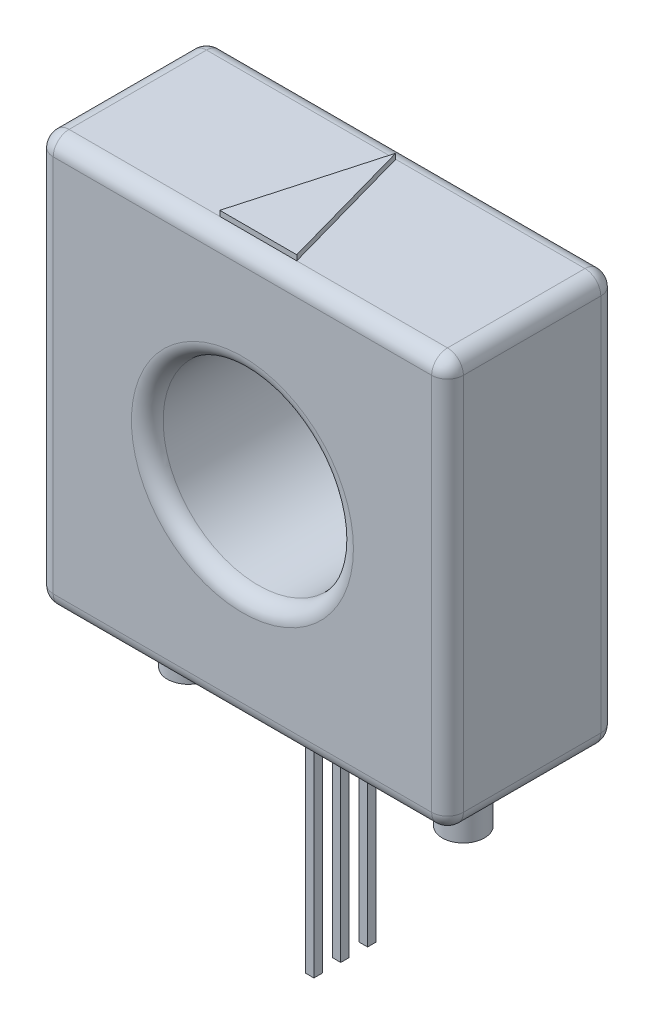
from build123d import *

# Parameters (mm, degrees)
SKETCH1_W           = 19.4
SKETCH1_H           = 19.4
SKETCH1_R           = 4.5
BOSS_EXTRUDE1_DEPTH = 8
FILLET1_R           = 0.75
SKETCH2_W           = 0.45
SKETCH2_H           = 0.216666666
BOSS_EXTRUDE2_DEPTH = 0.01
BOSS_EXTRUDE3_DEPTH = 0.25
SKETCH4_R           = 1
SKETCH4_R_2         = 0.7
SKETCH4_W           = 0.4
SKETCH4_H           = 0.4
BOSS_EXTRUDE4_DEPTH = 3
SKETCH5_W           = 0.4
SKETCH5_H           = 0.4
BOSS_EXTRUDE5_DEPTH = 9


with BuildPart() as part:
    # Sketch1 → Boss-Extrude1 (new body)
    with BuildSketch(Plane.XY):
        with Locations((9.7, -9.7)):
            Rectangle(SKETCH1_W, SKETCH1_H)
        with Locations((9.7, -9.7)):
            Circle(SKETCH1_R, mode=Mode.SUBTRACT)
    extrude(amount=BOSS_EXTRUDE1_DEPTH)

    # Fillet1
    fillet1_edges = [part.edges().sort_by_distance(p)[0] for p in [
        (19.4, -19.4, 4),
        (0, -19.4, 4),
        (0, 0, 4),
        (19.4, 0, 4),
        (19.4, -9.7, 8),
        (9.7, 0, 8),
        (0, -9.7, 8),
        (9.7, -19.4, 8),
        (9.7, -19.4, 0),
        (5.2, -9.7, 8),
        (0, -9.7, 0),
        (9.7, 0, 0),
        (19.4, -9.7, 0),
        (5.2, -9.7, 0),
    ]]
    fillet(fillet1_edges, radius=FILLET1_R)

    # Sketch2 → Boss-Extrude2 (add)
    # profile 1 of 13: a face of its own
    with BuildSketch(Plane(origin=(0, 0, 0), x_dir=(-1, 0, 0), z_dir=(0, 0, -1))):
        Polygon((-16.083333333, -2.4), (-15.842447917, -2.4), (-15.65, -3.229947917), (-15.429427083, -2.4), (-15.202604167, -2.4), (-14.983333333, -3.229947917), (-14.79140625, -2.4), (-14.55, -2.4), (-14.85078125, -3.7), (-15.09453125, -3.7), (-15.316666667, -2.859635417), (-15.540104167, -3.7), (-15.78203125, -3.7), align=None)
    # profile 2 of 13: a face of its own
    with BuildSketch(Plane(origin=(0, 0, 0), x_dir=(-1, 0, 0), z_dir=(0, 0, -1))):
        with BuildLine():
            Line((-13.175, -2.625520833), (-13.34609375, -2.7890625))
            add(Edge.make_bspline(
                [(-13.34609375, -2.7890625), (-13.360607316, -2.774055449), (-13.388956857, -2.744741976), (-13.434638636, -2.705933521), (-13.482146022, -2.673591925), (-13.530554856, -2.646354039), (-13.58073587, -2.625746637), (-13.632108836, -2.610729676), (-13.685001786, -2.601574402), (-13.7207977, -2.600526877), (-13.738802083, -2.6)],
                knots=[0, 0, 0, 0, 1.115251505, 2.178435587, 3.19620269, 4.182487026, 5.141301733, 6.088180966, 7.038406374, 8, 8, 8, 8], degree=3))
            add(Edge.make_bspline(
                [(-13.738802083, -2.6), (-13.753837931, -2.600416251), (-13.783509521, -2.601237677), (-13.827075189, -2.607259541), (-13.868748003, -2.617499983), (-13.908670614, -2.631613208), (-13.946725549, -2.649874972), (-13.982992594, -2.672271142), (-14.017382335, -2.698599447), (-14.049440503, -2.728723664), (-14.078766188, -2.761636634), (-14.104677299, -2.796754696), (-14.12638201, -2.833997394), (-14.144194713, -2.872987563), (-14.158070121, -2.913905667), (-14.167978905, -2.956724161), (-14.173709881, -3.001494036), (-14.174565267, -3.031928264), (-14.175, -3.047395833)],
                knots=[0, 0, 0, 0, 1.035432265, 2.043311493, 3.022114605, 3.98653278, 4.95457646, 5.923598177, 6.917315552, 7.932509744, 8.948865224, 9.949768934, 10.933144597, 11.912367597, 12.897413939, 13.903909035, 14.934704909, 16, 16, 16, 16], degree=3))
            add(Edge.make_bspline(
                [(-14.175, -3.047395833), (-14.174874715, -3.058252056), (-14.174627776, -3.079649894), (-14.171924589, -3.111303235), (-14.16757182, -3.142014459), (-14.161272286, -3.171737047), (-14.153394656, -3.200496756), (-14.144152402, -3.228541696), (-14.132558131, -3.255484347), (-14.119688315, -3.281637632), (-14.104720867, -3.306287925), (-14.088583198, -3.329794026), (-14.07108453, -3.352040709), (-14.052111523, -3.37293703), (-14.031397157, -3.392156425), (-14.009476821, -3.410276846), (-13.98598075, -3.426844675), (-13.961397015, -3.442275702), (-13.935513246, -3.455680767), (-13.909031728, -3.467823165), (-13.881550948, -3.477684598), (-13.853405502, -3.485633813), (-13.82469597, -3.492393432), (-13.795141549, -3.496555538), (-13.764998436, -3.499707452), (-13.744626751, -3.499902064), (-13.734375, -3.5)],
                knots=[0, 0, 0, 0, 1.103660481, 2.175337485, 3.227646561, 4.255952547, 5.262355991, 6.258840057, 7.255597736, 8.242457506, 9.22035537, 10.185017736, 11.140346927, 12.096287581, 13.051739095, 14.01125915, 14.986044842, 15.97314143, 16.960198552, 17.947847494, 18.933482797, 19.925264591, 20.920966487, 21.929612487, 22.958107872, 24, 24, 24, 24], degree=3))
            add(Edge.make_bspline(
                [(-13.734375, -3.5), (-13.716986268, -3.499497026), (-13.682821931, -3.498508812), (-13.632680855, -3.490781119), (-13.584901404, -3.478069501), (-13.546725852, -3.46305782), (-13.516816315, -3.448233589), (-13.494046627, -3.434521906), (-13.470500995, -3.419183883), (-13.446570491, -3.401640646), (-13.421985945, -3.382102722), (-13.397181332, -3.360142193), (-13.371521648, -3.336482188), (-13.354712243, -3.319595578), (-13.34609375, -3.3109375)],
                knots=[0, 0, 0, 0, 1.404581149, 2.759636711, 4.088442092, 5.392261763, 6.066678138, 6.783632037, 7.538459478, 8.336747902, 9.180226004, 10.074962426, 11.012997595, 12, 12, 12, 12], degree=3))
            Line((-13.34609375, -3.3109375), (-13.180208333, -3.48515625))
            add(Edge.make_bspline(
                [(-13.180208333, -3.48515625), (-13.191869185, -3.496414436), (-13.214628674, -3.518388009), (-13.248960732, -3.549588431), (-13.283249581, -3.577625479), (-13.316666875, -3.603516774), (-13.349760024, -3.62650804), (-13.382525518, -3.64662224), (-13.414592437, -3.664368089), (-13.446626662, -3.679446313), (-13.478827525, -3.692249292), (-13.51195843, -3.703271816), (-13.54612066, -3.712596475), (-13.581522862, -3.72012025), (-13.617834826, -3.726153302), (-13.655396385, -3.730225577), (-13.693969379, -3.732963232), (-13.720134039, -3.733209233), (-13.733333333, -3.733333333)],
                knots=[0, 0, 0, 0, 1.244526981, 2.429050516, 3.560637417, 4.644440555, 5.67424972, 6.652764056, 7.595344123, 8.486817594, 9.369275933, 10.254498637, 11.166417451, 12.086725134, 13.032340136, 13.991389299, 14.986715468, 16, 16, 16, 16], degree=3))
            add(Edge.make_bspline(
                [(-13.733333333, -3.733333333), (-13.757578803, -3.732715268), (-13.805020447, -3.731505886), (-13.87454494, -3.722545183), (-13.940591342, -3.707522723), (-14.003320331, -3.686276821), (-14.062711962, -3.659136176), (-14.11875104, -3.62586302), (-14.171347242, -3.586545755), (-14.220075695, -3.541645216), (-14.2641529, -3.49205634), (-14.303112045, -3.438811492), (-14.335339051, -3.381648993), (-14.362097828, -3.321413314), (-14.38302284, -3.257829578), (-14.397750501, -3.190829007), (-14.406832943, -3.120476292), (-14.407826575, -3.072423766), (-14.408333333, -3.047916667)],
                knots=[0, 0, 0, 0, 1.078019885, 2.10938526, 3.111377082, 4.085535484, 5.04941344, 6.010039228, 6.978205633, 7.964457913, 8.951525778, 9.924444315, 10.892603023, 11.863865945, 12.85144698, 13.863884204, 14.910567087, 16, 16, 16, 16], degree=3))
            add(Edge.make_bspline(
                [(-14.408333333, -3.047916667), (-14.408119202, -3.031933345), (-14.407694845, -3.000258309), (-14.403234817, -2.953598414), (-14.397017279, -2.908113362), (-14.38715372, -2.86427544), (-14.375264172, -2.821494069), (-14.360477958, -2.780234233), (-14.342818692, -2.740377347), (-14.322855575, -2.701856688), (-14.3002715, -2.664924608), (-14.275042609, -2.629898412), (-14.247818392, -2.596507703), (-14.217944695, -2.565195472), (-14.185855623, -2.535686792), (-14.151406297, -2.508141574), (-14.114803912, -2.48216479), (-14.075949399, -2.458426319), (-14.035597598, -2.436953609), (-13.994257452, -2.418013762), (-13.952030528, -2.402184412), (-13.909095366, -2.389054549), (-13.865270564, -2.379254036), (-13.820868934, -2.371835363), (-13.775512671, -2.367688277), (-13.74505987, -2.367009373), (-13.7296875, -2.366666667)],
                knots=[0, 0, 0, 0, 1.071919942, 2.124283339, 3.142214191, 4.149696895, 5.136002878, 6.119640489, 7.086990633, 8.058538607, 9.028339693, 9.988281803, 10.952401235, 11.916291999, 12.888973767, 13.874849856, 14.873389453, 15.898127285, 16.927174885, 17.938320013, 18.946391617, 19.950418109, 20.947802303, 21.956882652, 22.968648068, 24, 24, 24, 24], degree=3))
            add(Edge.make_bspline(
                [(-13.7296875, -2.366666667), (-13.716573292, -2.366863115), (-13.690481228, -2.367253968), (-13.651625766, -2.370512154), (-13.613081052, -2.375629103), (-13.574985088, -2.383349489), (-13.537065372, -2.392514563), (-13.499820212, -2.404514963), (-13.462662045, -2.417891671), (-13.426173643, -2.433880793), (-13.390304072, -2.451334365), (-13.355893634, -2.471136075), (-13.322364581, -2.49206735), (-13.290459896, -2.515366993), (-13.259581936, -2.540189884), (-13.229892165, -2.566651834), (-13.201651127, -2.595194043), (-13.18392862, -2.615360798), (-13.175, -2.625520833)],
                knots=[0, 0, 0, 0, 0.996412454, 1.982464992, 2.961075852, 3.949442424, 4.934965278, 5.923860011, 6.921385422, 7.934793307, 8.949617135, 9.951082467, 10.950285876, 11.951772932, 12.951063433, 13.960125323, 14.972308753, 16, 16, 16, 16], degree=3))
        make_face()
    # profile 3 of 13: a face of its own
    with BuildSketch(Plane(origin=(0, 0, 0), x_dir=(-1, 0, 0), z_dir=(0, 0, -1))):
        with BuildLine():
            Line((-12.275, -2.573697917), (-12.449479167, -2.733333333))
            add(Edge.make_bspline(
                [(-12.449479167, -2.733333333), (-12.456953106, -2.722790565), (-12.471302027, -2.70254992), (-12.494560132, -2.675447219), (-12.517713215, -2.652326598), (-12.540975774, -2.633284644), (-12.564554001, -2.618437052), (-12.588406967, -2.607924793), (-12.612399443, -2.60124205), (-12.628518683, -2.600409888), (-12.636458333, -2.6)],
                knots=[0, 0, 0, 0, 1.299362458, 2.494594718, 3.587462134, 4.587049575, 5.512617175, 6.380583204, 7.202344345, 8, 8, 8, 8], degree=3))
            add(Edge.make_bspline(
                [(-12.636458333, -2.6), (-12.643864211, -2.600259724), (-12.658163016, -2.600761182), (-12.678547023, -2.605745638), (-12.696644235, -2.614348076), (-12.71243699, -2.625596489), (-12.724947181, -2.639148218), (-12.734935599, -2.653360498), (-12.740559918, -2.66904764), (-12.741300189, -2.679822203), (-12.741666667, -2.68515625)],
                knots=[0, 0, 0, 0, 1.185010067, 2.2879431, 3.333075148, 4.379039566, 5.372662701, 6.27520591, 7.14612461, 8, 8, 8, 8], degree=3))
            add(Edge.make_bspline(
                [(-12.741666667, -2.68515625), (-12.741437013, -2.690567217), (-12.740974524, -2.701464152), (-12.736507503, -2.717434968), (-12.729774428, -2.733040314), (-12.723340699, -2.74254003), (-12.720052083, -2.747395833)],
                knots=[0, 0, 0, 0, 0.967525499, 1.948461899, 2.951351359, 4, 4, 4, 4], degree=3))
            add(Edge.make_bspline(
                [(-12.720052083, -2.747395833), (-12.717062376, -2.751170198), (-12.710180464, -2.759858288), (-12.697058067, -2.773618867), (-12.680579093, -2.790476782), (-12.660109396, -2.809852337), (-12.636498729, -2.832442353), (-12.608652707, -2.857358809), (-12.57737286, -2.885373337), (-12.55513987, -2.90488164), (-12.543489583, -2.915104167)],
                knots=[0, 0, 0, 0, 0.473873513, 1.090794244, 1.870441696, 2.795289791, 3.865433203, 5.087734844, 6.473946851, 8, 8, 8, 8], degree=3))
            add(Edge.make_bspline(
                [(-12.543489583, -2.915104167), (-12.532554113, -2.924568265), (-12.511800863, -2.942529156), (-12.482273108, -2.968021758), (-12.45632313, -2.99095683), (-12.433572896, -3.010990166), (-12.414367278, -3.028331962), (-12.398625534, -3.043065111), (-12.386155407, -3.054902786), (-12.379066869, -3.062052749), (-12.376041667, -3.065104167)],
                knots=[0, 0, 0, 0, 1.543621617, 2.929473131, 4.163658386, 5.240097082, 6.164993805, 6.925417477, 7.541396219, 8, 8, 8, 8], degree=3))
            add(Edge.make_bspline(
                [(-12.376041667, -3.065104167), (-12.364564678, -3.077524726), (-12.342501876, -3.101401404), (-12.31382801, -3.138402745), (-12.290228491, -3.174523598), (-12.271971456, -3.210443637), (-12.258183009, -3.246681115), (-12.24846197, -3.284124755), (-12.242639976, -3.323165819), (-12.241993599, -3.34980658), (-12.241666667, -3.36328125)],
                knots=[0, 0, 0, 0, 1.206664779, 2.319633467, 3.337109185, 4.282041471, 5.190008762, 6.099243693, 7.03861361, 8, 8, 8, 8], degree=3))
            add(Edge.make_bspline(
                [(-12.241666667, -3.36328125), (-12.241899369, -3.376410664), (-12.242355938, -3.402171062), (-12.247948044, -3.439867568), (-12.255922057, -3.47594476), (-12.268251281, -3.510010067), (-12.283278067, -3.542622662), (-12.302116312, -3.573274543), (-12.324239249, -3.60227592), (-12.349595531, -3.629108359), (-12.377642589, -3.653456936), (-12.407725725, -3.675132616), (-12.440139107, -3.69302865), (-12.474605799, -3.707764757), (-12.511107352, -3.719114705), (-12.549600282, -3.727503373), (-12.590143466, -3.73253812), (-12.61786748, -3.733064443), (-12.63203125, -3.733333333)],
                knots=[0, 0, 0, 0, 1.043214005, 2.046824704, 3.02475056, 3.976699089, 4.921714032, 5.875962561, 6.831408892, 7.817874052, 8.806269674, 9.781291748, 10.760897367, 11.74438705, 12.757449933, 13.795994037, 14.874007457, 16, 16, 16, 16], degree=3))
            add(Edge.make_bspline(
                [(-12.63203125, -3.733333333), (-12.643149689, -3.733136085), (-12.665170573, -3.73274542), (-12.697626029, -3.729555964), (-12.728965439, -3.724408521), (-12.759153505, -3.717030698), (-12.788326227, -3.707681996), (-12.816484805, -3.696262915), (-12.843434851, -3.682596462), (-12.86938028, -3.666963676), (-12.894194966, -3.648811951), (-12.918192682, -3.628512395), (-12.941135059, -3.605752791), (-12.963132285, -3.580586964), (-12.984043615, -3.552943651), (-13.004553552, -3.523207836), (-13.023750573, -3.490827664), (-13.035609427, -3.46811271), (-13.041666667, -3.456510417)],
                knots=[0, 0, 0, 0, 1.016823716, 2.013894106, 2.979844003, 3.91962641, 4.853723003, 5.779685073, 6.695824784, 7.614987388, 8.547259901, 9.504950863, 10.487499108, 11.500346958, 12.559593716, 13.656357062, 14.802919212, 16, 16, 16, 16], degree=3))
            Line((-13.041666667, -3.456510417), (-12.836458333, -3.333333333))
            add(Edge.make_bspline(
                [(-12.836458333, -3.333333333), (-12.828881632, -3.346503453), (-12.814356449, -3.371751697), (-12.789742167, -3.405675914), (-12.764526093, -3.43472639), (-12.738125251, -3.458389656), (-12.710860668, -3.476982121), (-12.682600649, -3.490269587), (-12.653325338, -3.498494513), (-12.633384327, -3.499498966), (-12.6234375, -3.5)],
                knots=[0, 0, 0, 0, 1.283663364, 2.460892379, 3.537111102, 4.529833553, 5.449777664, 6.316464042, 7.160231139, 8, 8, 8, 8], degree=3))
            add(Edge.make_bspline(
                [(-12.6234375, -3.5), (-12.613320153, -3.499590828), (-12.593691027, -3.498796976), (-12.56567296, -3.491464402), (-12.539984936, -3.479951721), (-12.517780398, -3.463524714), (-12.498978995, -3.444565452), (-12.48510248, -3.423472405), (-12.47638516, -3.400650238), (-12.475463528, -3.384796459), (-12.475, -3.376822917)],
                knots=[0, 0, 0, 0, 1.13588714, 2.203786484, 3.234766741, 4.283437687, 5.291419208, 6.222934724, 7.106237994, 8, 8, 8, 8], degree=3))
            add(Edge.make_bspline(
                [(-12.475, -3.376822917), (-12.475428049, -3.369404833), (-12.47629759, -3.354335707), (-12.482702362, -3.331930339), (-12.492714973, -3.30953516), (-12.504560599, -3.291166029), (-12.516615006, -3.275786053), (-12.528141738, -3.26246), (-12.542178249, -3.247737044), (-12.558688948, -3.231598666), (-12.577455685, -3.213902794), (-12.59849427, -3.194651161), (-12.622045615, -3.174013352), (-12.638691753, -3.159955081), (-12.647395833, -3.152604167)],
                knots=[0, 0, 0, 0, 0.916159276, 1.861089862, 2.860218735, 3.940849679, 4.552606315, 5.27541173, 6.11797699, 7.06649574, 8.129236253, 9.306560635, 10.591630461, 12, 12, 12, 12], degree=3))
            add(Edge.make_bspline(
                [(-12.647395833, -3.152604167), (-12.663942637, -3.138603984), (-12.695700961, -3.111733396), (-12.740579503, -3.072046384), (-12.781019087, -3.034955235), (-12.816670434, -3.000001421), (-12.847987798, -2.967830457), (-12.874759083, -2.93818104), (-12.896690195, -2.910824465), (-12.919767962, -2.878422432), (-12.941696455, -2.838938328), (-12.960648895, -2.791434374), (-12.972944438, -2.743936448), (-12.974321983, -2.712048957), (-12.975, -2.696354167)],
                knots=[0, 0, 0, 0, 1.345494975, 2.582412109, 3.71882943, 4.751509156, 5.681369928, 6.505683931, 7.230279997, 7.856715994, 8.973648664, 10.023341002, 11.027102913, 12, 12, 12, 12], degree=3))
            add(Edge.make_bspline(
                [(-12.975, -2.696354167), (-12.974718013, -2.685224264), (-12.97416247, -2.66329716), (-12.969206934, -2.631056549), (-12.961800697, -2.599947069), (-12.951044714, -2.57008222), (-12.937084747, -2.54149941), (-12.92013091, -2.514058714), (-12.899919941, -2.48801269), (-12.877143544, -2.463378604), (-12.852049785, -2.440865853), (-12.825233915, -2.420996095), (-12.796847714, -2.404213808), (-12.767064834, -2.390291682), (-12.735700723, -2.37963518), (-12.702986439, -2.372081319), (-12.668875059, -2.367588524), (-12.645673235, -2.366977781), (-12.633854167, -2.366666667)],
                knots=[0, 0, 0, 0, 1.010766082, 1.991317756, 2.957454644, 3.913069143, 4.869106762, 5.843196583, 6.838735724, 7.860187025, 8.887984031, 9.89767229, 10.887916223, 11.879572884, 12.879850636, 13.892031539, 14.926195476, 16, 16, 16, 16], degree=3))
            add(Edge.make_bspline(
                [(-12.633854167, -2.366666667), (-12.618537239, -2.367226993), (-12.58802429, -2.368343221), (-12.542910014, -2.377071765), (-12.498844276, -2.390798319), (-12.463335279, -2.407357897), (-12.435081432, -2.423399167), (-12.413427498, -2.438167948), (-12.391393455, -2.455086381), (-12.368801611, -2.47420778), (-12.346071758, -2.495892416), (-12.322557578, -2.519624072), (-12.29857948, -2.545607842), (-12.282997519, -2.564170527), (-12.275, -2.573697917)],
                knots=[0, 0, 0, 0, 1.282922637, 2.555718331, 3.837320111, 5.142675274, 5.830281639, 6.55870424, 7.337177975, 8.157850921, 9.037902056, 9.96903443, 10.957596896, 12, 12, 12, 12], degree=3))
        make_face()
    # profile 4 of 13: a face of its own
    with BuildSketch(Plane(origin=(0, 0, 0), x_dir=(-1, 0, 0), z_dir=(0, 0, -1))):
        Polygon((-11.869010417, -2.4), (-11.508333333, -2.4), (-11.508333333, -3.7), (-11.741666667, -3.7), (-11.741666667, -2.616666667), (-12.008333333, -2.616666667), align=None)
    # profile 5 of 13: a face of its own
    with BuildSketch(Plane(origin=(0, 0, 0), x_dir=(-1, 0, 0), z_dir=(0, 0, -1))):
        Polygon((-11.058333333, -2.4), (-10.225, -2.4), (-10.225, -2.52109375), (-10.7984375, -3.733333333), (-11.005208333, -3.629166667), (-10.526041667, -2.616666667), (-11.058333333, -2.616666667), align=None)
    # profile 6 of 13: a face of its own
    with BuildSketch(Plane(origin=(0, 0, 0), x_dir=(-1, 0, 0), z_dir=(0, 0, -1))):
        with BuildLine():
            add(Edge.make_bspline(
                [(-9.670572917, -2.366666667), (-9.659278615, -2.366834334), (-9.637071, -2.367164012), (-9.604363363, -2.370734697), (-9.572856866, -2.376129005), (-9.542428251, -2.383652185), (-9.513296547, -2.393608844), (-9.485249726, -2.405526796), (-9.458621628, -2.420031159), (-9.433072658, -2.436414583), (-9.408612658, -2.454962941), (-9.385829508, -2.476109027), (-9.364307138, -2.499366269), (-9.344511429, -2.525086274), (-9.326003999, -2.553035091), (-9.308845659, -2.583217153), (-9.293167762, -2.61578018), (-9.278794595, -2.650782935), (-9.265942064, -2.688750095), (-9.255116392, -2.730117158), (-9.245831568, -2.774893572), (-9.237994521, -2.823190792), (-9.23207098, -2.875073016), (-9.228078394, -2.930505778), (-9.225338493, -2.989382209), (-9.225114881, -3.029770958), (-9.225, -3.050520833)],
                knots=[0, 0, 0, 0, 0.879237366, 1.728815576, 2.559023295, 3.367336655, 4.166867292, 4.954216142, 5.737608147, 6.525189134, 7.316157332, 8.124696809, 8.942788509, 9.781158001, 10.649253743, 11.551476218, 12.482711956, 13.461909668, 14.496590415, 15.601789533, 16.789733467, 18.056700938, 19.410929216, 20.8549011, 22.384193279, 24, 24, 24, 24], degree=3))
            add(Edge.make_bspline(
                [(-9.225, -3.050520833), (-9.225124156, -3.071530313), (-9.225365388, -3.112351356), (-9.227964496, -3.171766301), (-9.232440282, -3.227601538), (-9.238208999, -3.279851288), (-9.246110563, -3.328487961), (-9.255364393, -3.373637493), (-9.266360944, -3.415283517), (-9.279636833, -3.453332197), (-9.293922999, -3.488396424), (-9.309643782, -3.520895961), (-9.326525172, -3.550918834), (-9.344179959, -3.57891798), (-9.363576045, -3.604067996), (-9.383769367, -3.627224117), (-9.405639179, -3.647504294), (-9.428264677, -3.665953678), (-9.452474724, -3.681897648), (-9.478019649, -3.695841981), (-9.505354873, -3.707152492), (-9.533982122, -3.71698977), (-9.564389353, -3.724051874), (-9.596093398, -3.729655422), (-9.629452192, -3.732752286), (-9.652164202, -3.733136472), (-9.663802083, -3.733333333)],
                knots=[0, 0, 0, 0, 1.643780988, 3.193836972, 4.651895693, 6.025988579, 7.305620092, 8.505800249, 9.631074763, 10.672816429, 11.65661981, 12.592235626, 13.49536222, 14.350718032, 15.179365177, 15.97804903, 16.751647189, 17.51006938, 18.259804725, 19.016521909, 19.783502495, 20.571750527, 21.382245291, 22.22305063, 23.089471752, 24, 24, 24, 24], degree=3))
            add(Edge.make_bspline(
                [(-9.663802083, -3.733333333), (-9.675439651, -3.733132675), (-9.698237475, -3.732739587), (-9.731686474, -3.729678448), (-9.763558535, -3.724029174), (-9.794206336, -3.716935552), (-9.823416572, -3.707174258), (-9.851329306, -3.695525345), (-9.877729912, -3.681668017), (-9.902691491, -3.665686899), (-9.926128816, -3.647360956), (-9.948406104, -3.626886203), (-9.969474074, -3.60431454), (-9.989012232, -3.579393144), (-10.007340556, -3.552454666), (-10.02426791, -3.523191479), (-10.039784121, -3.491646191), (-10.05437454, -3.457774832), (-10.067051767, -3.420848188), (-10.078333911, -3.380536511), (-10.087575946, -3.336503769), (-10.095009009, -3.288764107), (-10.100943562, -3.237418666), (-10.105358188, -3.182442661), (-10.107971733, -3.123810486), (-10.108210435, -3.083509671), (-10.108333333, -3.062760417)],
                knots=[0, 0, 0, 0, 0.917216111, 1.796812873, 2.643793957, 3.46689424, 4.273913431, 5.068098542, 5.848489301, 6.620921603, 7.401012384, 8.190319798, 9.003608147, 9.831726257, 10.68377682, 11.569763213, 12.493818149, 13.453288342, 14.474581811, 15.568529029, 16.750744269, 18.018426408, 19.375425659, 20.823733699, 22.36466933, 24, 24, 24, 24], degree=3))
            add(Edge.make_bspline(
                [(-10.108333333, -3.062760417), (-10.108110715, -3.033930961), (-10.107681169, -2.978304155), (-10.102237653, -2.897939594), (-10.094247952, -2.823656478), (-10.082512974, -2.755579065), (-10.068002836, -2.693455216), (-10.049421848, -2.63769417), (-10.028268745, -2.587524349), (-10.010243584, -2.557803445), (-10.0015625, -2.543489583)],
                knots=[0, 0, 0, 0, 1.288568992, 2.486310467, 3.599230591, 4.627010532, 5.572937695, 6.447898582, 7.252493626, 8, 8, 8, 8], degree=3))
            add(Edge.make_bspline(
                [(-10.0015625, -2.543489583), (-9.991468549, -2.52942765), (-9.971732886, -2.501933799), (-9.937224527, -2.465839513), (-9.900149788, -2.434969911), (-9.859747176, -2.410023602), (-9.816655674, -2.39035094), (-9.77050532, -2.376456361), (-9.721466539, -2.368360731), (-9.68779079, -2.367239787), (-9.670572917, -2.366666667)],
                knots=[0, 0, 0, 0, 1.058512271, 2.069600068, 3.047294572, 4.004278952, 4.967380941, 5.939006123, 6.946246673, 8, 8, 8, 8], degree=3))
        make_face()
        with BuildLine():
            add(Edge.make_bspline(
                [(-9.66484375, -2.6), (-9.675053892, -2.60048394), (-9.695071192, -2.601432721), (-9.724117246, -2.609486526), (-9.751505862, -2.621926062), (-9.772339651, -2.636895099), (-9.787933535, -2.651244716), (-9.798829093, -2.664230653), (-9.809336142, -2.678722022), (-9.818616497, -2.695372746), (-9.827379574, -2.713584543), (-9.835943742, -2.733440084), (-9.84296411, -2.755427064), (-9.849861437, -2.779171043), (-9.855904138, -2.805328477), (-9.860966597, -2.834113176), (-9.865489459, -2.865712329), (-9.868644209, -2.900146633), (-9.871585383, -2.937380062), (-9.873693756, -2.977495557), (-9.874575214, -3.020482295), (-9.874855403, -3.050086624), (-9.875, -3.065364583)],
                knots=[0, 0, 0, 0, 1.076674018, 2.110852608, 3.161083442, 4.239746716, 4.804137807, 5.395870207, 6.026861976, 6.692161227, 7.405688833, 8.16177676, 8.973626916, 9.841385931, 10.773283133, 11.807421078, 12.927755683, 14.143907515, 15.458935494, 16.872852025, 18.386167141, 20, 20, 20, 20], degree=3))
            add(Edge.make_bspline(
                [(-9.875, -3.065364583), (-9.87476201, -3.085157918), (-9.874305647, -3.123113105), (-9.87191543, -3.177693984), (-9.867124439, -3.22736698), (-9.861165413, -3.272468744), (-9.852795718, -3.312706779), (-9.843165842, -3.348461774), (-9.831273802, -3.37927794), (-9.817530257, -3.405600948), (-9.802308663, -3.427993876), (-9.785784952, -3.447027965), (-9.768521699, -3.463510589), (-9.749980061, -3.476899221), (-9.730204272, -3.487159651), (-9.709359425, -3.494539852), (-9.687432272, -3.499057581), (-9.672416784, -3.499684044), (-9.66484375, -3.5)],
                knots=[0, 0, 0, 0, 1.771748488, 3.397459088, 4.888034009, 6.237357457, 7.467047327, 8.564189669, 9.548206622, 10.417051504, 11.216568818, 11.965764335, 12.669334354, 13.348544111, 14.005342236, 14.656555988, 15.322436492, 16, 16, 16, 16], degree=3))
            add(Edge.make_bspline(
                [(-9.66484375, -3.5), (-9.657530599, -3.4997838), (-9.643212358, -3.499360506), (-9.622333156, -3.495015454), (-9.602588299, -3.487951344), (-9.584037403, -3.477958665), (-9.566614114, -3.465251444), (-9.550403586, -3.44977384), (-9.535528076, -3.431371578), (-9.526861537, -3.417714379), (-9.522395833, -3.410677083)],
                knots=[0, 0, 0, 0, 0.992283464, 1.942767638, 2.88273346, 3.832339453, 4.79467288, 5.803907806, 6.868395428, 8, 8, 8, 8], degree=3))
            add(Edge.make_bspline(
                [(-9.522395833, -3.410677083), (-9.51713822, -3.401060844), (-9.506113431, -3.38089637), (-9.493355526, -3.346869572), (-9.482616633, -3.308492968), (-9.473373824, -3.265647126), (-9.467052307, -3.218163056), (-9.461608224, -3.16634186), (-9.458982408, -3.109922587), (-9.458555305, -3.070835111), (-9.458333333, -3.050520833)],
                knots=[0, 0, 0, 0, 0.710965849, 1.490837728, 2.352621235, 3.297892224, 4.334225155, 5.461620853, 6.680770821, 8, 8, 8, 8], degree=3))
            add(Edge.make_bspline(
                [(-9.458333333, -3.050520833), (-9.458419076, -3.030030218), (-9.458584116, -2.990589281), (-9.461612123, -2.933967177), (-9.465828855, -2.882252282), (-9.471996715, -2.835560054), (-9.479932789, -2.793777146), (-9.48971403, -2.756906288), (-9.501245385, -2.724874816), (-9.514920198, -2.69771467), (-9.530065904, -2.674632271), (-9.546143532, -2.654829363), (-9.563221067, -2.637922139), (-9.581269948, -2.623846976), (-9.600707924, -2.613092496), (-9.621163703, -2.605498943), (-9.642679222, -2.600905098), (-9.657355852, -2.600305772), (-9.66484375, -2.6)],
                knots=[0, 0, 0, 0, 1.793836731, 3.452829483, 4.963243077, 6.335886805, 7.574563692, 8.684454726, 9.672768357, 10.54971625, 11.340229787, 12.085688095, 12.778991901, 13.440269426, 14.083255152, 14.715733572, 15.344777694, 16, 16, 16, 16], degree=3))
        make_face(mode=Mode.SUBTRACT)
    # profile 7 of 13: a face of its own
    with BuildSketch(Plane(origin=(0, 0, 0), x_dir=(-1, 0, 0), z_dir=(0, 0, -1))):
        with BuildLine():
            add(Edge.make_bspline(
                [(-8.670572917, -2.366666667), (-8.659278615, -2.366834334), (-8.637071, -2.367164012), (-8.604363363, -2.370734697), (-8.572856866, -2.376129005), (-8.542428251, -2.383652185), (-8.513296547, -2.393608844), (-8.485249726, -2.405526796), (-8.458621628, -2.420031159), (-8.433072658, -2.436414583), (-8.408612658, -2.454962941), (-8.385829508, -2.476109027), (-8.364307138, -2.499366269), (-8.344511429, -2.525086274), (-8.326003999, -2.553035091), (-8.308845659, -2.583217153), (-8.293167762, -2.61578018), (-8.278794595, -2.650782935), (-8.265942064, -2.688750095), (-8.255116392, -2.730117158), (-8.245831568, -2.774893572), (-8.237994521, -2.823190792), (-8.23207098, -2.875073016), (-8.228078394, -2.930505778), (-8.225338493, -2.989382209), (-8.225114881, -3.029770958), (-8.225, -3.050520833)],
                knots=[0, 0, 0, 0, 0.879237366, 1.728815576, 2.559023295, 3.367336655, 4.166867292, 4.954216142, 5.737608147, 6.525189134, 7.316157332, 8.124696809, 8.942788509, 9.781158001, 10.649253743, 11.551476218, 12.482711956, 13.461909668, 14.496590415, 15.601789533, 16.789733467, 18.056700938, 19.410929216, 20.8549011, 22.384193279, 24, 24, 24, 24], degree=3))
            add(Edge.make_bspline(
                [(-8.225, -3.050520833), (-8.225124156, -3.071530313), (-8.225365388, -3.112351356), (-8.227964496, -3.171766301), (-8.232440282, -3.227601538), (-8.238208999, -3.279851288), (-8.246110563, -3.328487961), (-8.255364393, -3.373637493), (-8.266360944, -3.415283517), (-8.279636833, -3.453332197), (-8.293922999, -3.488396424), (-8.309643782, -3.520895961), (-8.326525172, -3.550918834), (-8.344179959, -3.57891798), (-8.363576045, -3.604067996), (-8.383769367, -3.627224117), (-8.405639179, -3.647504294), (-8.428264677, -3.665953678), (-8.452474724, -3.681897648), (-8.478019649, -3.695841981), (-8.505354873, -3.707152492), (-8.533982122, -3.71698977), (-8.564389353, -3.724051874), (-8.596093398, -3.729655422), (-8.629452192, -3.732752286), (-8.652164202, -3.733136472), (-8.663802083, -3.733333333)],
                knots=[0, 0, 0, 0, 1.643780988, 3.193836972, 4.651895693, 6.025988579, 7.305620092, 8.505800249, 9.631074763, 10.672816429, 11.65661981, 12.592235626, 13.49536222, 14.350718032, 15.179365177, 15.97804903, 16.751647189, 17.51006938, 18.259804725, 19.016521909, 19.783502495, 20.571750527, 21.382245291, 22.22305063, 23.089471752, 24, 24, 24, 24], degree=3))
            add(Edge.make_bspline(
                [(-8.663802083, -3.733333333), (-8.675439651, -3.733132675), (-8.698237475, -3.732739587), (-8.731686474, -3.729678448), (-8.763558535, -3.724029174), (-8.794206336, -3.716935552), (-8.823416572, -3.707174258), (-8.851329306, -3.695525345), (-8.877729912, -3.681668017), (-8.902691491, -3.665686899), (-8.926128816, -3.647360956), (-8.948406104, -3.626886203), (-8.969474074, -3.60431454), (-8.989012232, -3.579393144), (-9.007340556, -3.552454666), (-9.02426791, -3.523191479), (-9.039784121, -3.491646191), (-9.05437454, -3.457774832), (-9.067051767, -3.420848188), (-9.078333911, -3.380536511), (-9.087575946, -3.336503769), (-9.095009009, -3.288764107), (-9.100943562, -3.237418666), (-9.105358188, -3.182442661), (-9.107971733, -3.123810486), (-9.108210435, -3.083509671), (-9.108333333, -3.062760417)],
                knots=[0, 0, 0, 0, 0.917216111, 1.796812873, 2.643793957, 3.46689424, 4.273913431, 5.068098542, 5.848489301, 6.620921603, 7.401012384, 8.190319798, 9.003608147, 9.831726257, 10.68377682, 11.569763213, 12.493818149, 13.453288342, 14.474581811, 15.568529029, 16.750744269, 18.018426408, 19.375425659, 20.823733699, 22.36466933, 24, 24, 24, 24], degree=3))
            add(Edge.make_bspline(
                [(-9.108333333, -3.062760417), (-9.108110715, -3.033930961), (-9.107681169, -2.978304155), (-9.102237653, -2.897939594), (-9.094247952, -2.823656478), (-9.082512974, -2.755579065), (-9.068002836, -2.693455216), (-9.049421848, -2.63769417), (-9.028268745, -2.587524349), (-9.010243584, -2.557803445), (-9.0015625, -2.543489583)],
                knots=[0, 0, 0, 0, 1.288568992, 2.486310467, 3.599230591, 4.627010532, 5.572937695, 6.447898582, 7.252493626, 8, 8, 8, 8], degree=3))
            add(Edge.make_bspline(
                [(-9.0015625, -2.543489583), (-8.991468549, -2.52942765), (-8.971732886, -2.501933799), (-8.937224527, -2.465839513), (-8.900149788, -2.434969911), (-8.859747176, -2.410023602), (-8.816655674, -2.39035094), (-8.77050532, -2.376456361), (-8.721466539, -2.368360731), (-8.68779079, -2.367239787), (-8.670572917, -2.366666667)],
                knots=[0, 0, 0, 0, 1.058512271, 2.069600068, 3.047294572, 4.004278952, 4.967380941, 5.939006123, 6.946246673, 8, 8, 8, 8], degree=3))
        make_face()
        with BuildLine():
            add(Edge.make_bspline(
                [(-8.66484375, -2.6), (-8.675053892, -2.60048394), (-8.695071192, -2.601432721), (-8.724117246, -2.609486526), (-8.751505862, -2.621926062), (-8.772339651, -2.636895099), (-8.787933535, -2.651244716), (-8.798829093, -2.664230653), (-8.809336142, -2.678722022), (-8.818616497, -2.695372746), (-8.827379574, -2.713584543), (-8.835943742, -2.733440084), (-8.84296411, -2.755427064), (-8.849861437, -2.779171043), (-8.855904138, -2.805328477), (-8.860966597, -2.834113176), (-8.865489459, -2.865712329), (-8.868644209, -2.900146633), (-8.871585383, -2.937380062), (-8.873693756, -2.977495557), (-8.874575214, -3.020482295), (-8.874855403, -3.050086624), (-8.875, -3.065364583)],
                knots=[0, 0, 0, 0, 1.076674018, 2.110852608, 3.161083442, 4.239746716, 4.804137807, 5.395870207, 6.026861976, 6.692161227, 7.405688833, 8.16177676, 8.973626916, 9.841385931, 10.773283133, 11.807421078, 12.927755683, 14.143907515, 15.458935494, 16.872852025, 18.386167141, 20, 20, 20, 20], degree=3))
            add(Edge.make_bspline(
                [(-8.875, -3.065364583), (-8.87476201, -3.085157918), (-8.874305647, -3.123113105), (-8.87191543, -3.177693984), (-8.867124439, -3.22736698), (-8.861165413, -3.272468744), (-8.852795718, -3.312706779), (-8.843165842, -3.348461774), (-8.831273802, -3.37927794), (-8.817530257, -3.405600948), (-8.802308663, -3.427993876), (-8.785784952, -3.447027965), (-8.768521699, -3.463510589), (-8.749980061, -3.476899221), (-8.730204272, -3.487159651), (-8.709359425, -3.494539852), (-8.687432272, -3.499057581), (-8.672416784, -3.499684044), (-8.66484375, -3.5)],
                knots=[0, 0, 0, 0, 1.771748488, 3.397459088, 4.888034009, 6.237357457, 7.467047327, 8.564189669, 9.548206622, 10.417051504, 11.216568818, 11.965764335, 12.669334354, 13.348544111, 14.005342236, 14.656555988, 15.322436492, 16, 16, 16, 16], degree=3))
            add(Edge.make_bspline(
                [(-8.66484375, -3.5), (-8.657530599, -3.4997838), (-8.643212358, -3.499360506), (-8.622333156, -3.495015454), (-8.602588299, -3.487951344), (-8.584037403, -3.477958665), (-8.566614114, -3.465251444), (-8.550403586, -3.44977384), (-8.535528076, -3.431371578), (-8.526861537, -3.417714379), (-8.522395833, -3.410677083)],
                knots=[0, 0, 0, 0, 0.992283464, 1.942767638, 2.88273346, 3.832339453, 4.79467288, 5.803907806, 6.868395428, 8, 8, 8, 8], degree=3))
            add(Edge.make_bspline(
                [(-8.522395833, -3.410677083), (-8.51713822, -3.401060844), (-8.506113431, -3.38089637), (-8.493355526, -3.346869572), (-8.482616633, -3.308492968), (-8.473373824, -3.265647126), (-8.467052307, -3.218163056), (-8.461608224, -3.16634186), (-8.458982408, -3.109922587), (-8.458555305, -3.070835111), (-8.458333333, -3.050520833)],
                knots=[0, 0, 0, 0, 0.710965849, 1.490837728, 2.352621235, 3.297892224, 4.334225155, 5.461620853, 6.680770821, 8, 8, 8, 8], degree=3))
            add(Edge.make_bspline(
                [(-8.458333333, -3.050520833), (-8.458419076, -3.030030218), (-8.458584116, -2.990589281), (-8.461612123, -2.933967177), (-8.465828855, -2.882252282), (-8.471996715, -2.835560054), (-8.479932789, -2.793777146), (-8.48971403, -2.756906288), (-8.501245385, -2.724874816), (-8.514920198, -2.69771467), (-8.530065904, -2.674632271), (-8.546143532, -2.654829363), (-8.563221067, -2.637922139), (-8.581269948, -2.623846976), (-8.600707924, -2.613092496), (-8.621163703, -2.605498943), (-8.642679222, -2.600905098), (-8.657355852, -2.600305772), (-8.66484375, -2.6)],
                knots=[0, 0, 0, 0, 1.793836731, 3.452829483, 4.963243077, 6.335886805, 7.574563692, 8.684454726, 9.672768357, 10.54971625, 11.340229787, 12.085688095, 12.778991901, 13.440269426, 14.083255152, 14.715733572, 15.344777694, 16, 16, 16, 16], degree=3))
        make_face(mode=Mode.SUBTRACT)
    # profile 8 of 13: a face of its own
    with BuildSketch(Plane(origin=(0, 0, 0), x_dir=(-1, 0, 0), z_dir=(0, 0, -1))):
        with Locations((-7.783333333, -3.225)):
            Rectangle(SKETCH2_W, SKETCH2_H)
    # profile 9 of 13: a face of its own
    with BuildSketch(Plane(origin=(0, 0, 0), x_dir=(-1, 0, 0), z_dir=(0, 0, -1))):
        Polygon((-7.337760417, -2.4), (-7.062760417, -2.4), (-6.791145833, -2.817447917), (-6.519010417, -2.4), (-6.24375, -2.4), (-6.653645833, -3.028645833), (-6.216666667, -3.7), (-6.491666667, -3.7), (-6.791145833, -3.239583333), (-7.09140625, -3.7), (-7.366666667, -3.7), (-6.928645833, -3.028385417), align=None)
    # profile 10 of 13: a face of its own
    with BuildSketch(Plane(origin=(0, 0, 0), x_dir=(-1, 0, 0), z_dir=(0, 0, -1))):
        Polygon((-6.12109375, -2.4), (-5.84609375, -2.4), (-5.574479167, -2.817447917), (-5.30234375, -2.4), (-5.027083333, -2.4), (-5.436979167, -3.028645833), (-5, -3.7), (-5.275, -3.7), (-5.574479167, -3.239583333), (-5.874739583, -3.7), (-6.15, -3.7), (-5.711979167, -3.028385417), align=None)
    # profile 11 of 13: a face of its own
    with BuildSketch(Plane(origin=(0, 0, 0), x_dir=(-1, 0, 0), z_dir=(0, 0, -1))):
        Polygon((-4.904427083, -2.4), (-4.629427083, -2.4), (-4.3578125, -2.817447917), (-4.085677083, -2.4), (-3.810416667, -2.4), (-4.2203125, -3.028645833), (-3.783333333, -3.7), (-4.058333333, -3.7), (-4.3578125, -3.239583333), (-4.658072917, -3.7), (-4.933333333, -3.7), (-4.4953125, -3.028385417), align=None)
    # profile 12 of 13: a face of its own
    with BuildSketch(Plane(origin=(0, 0, 0), x_dir=(-1, 0, 0), z_dir=(0, 0, -1))):
        Polygon((-3.687760417, -2.4), (-3.412760417, -2.4), (-3.141145833, -2.817447917), (-2.869010417, -2.4), (-2.59375, -2.4), (-3.003645833, -3.028645833), (-2.566666667, -3.7), (-2.841666667, -3.7), (-3.141145833, -3.239583333), (-3.44140625, -3.7), (-3.716666667, -3.7), (-3.278645833, -3.028385417), align=None)
    # profile 13 of 13: a face of its own
    with BuildSketch(Plane(origin=(0, 0, 0), x_dir=(-1, 0, 0), z_dir=(0, 0, -1))):
        Polygon((-9.453205128, -17.046153846), (-9.453205128, -17.783333333), (-9.228846154, -17.783333333), (-9.228846154, -17.046153846), (-8.491666667, -17.046153846), (-8.491666667, -16.821794872), (-9.228846154, -16.821794872), (-9.228846154, -16.084615385), (-9.453205128, -16.084615385), (-9.453205128, -16.821794872), (-10.190384615, -16.821794872), (-10.190384615, -17.046153846), align=None)
    extrude(amount=BOSS_EXTRUDE2_DEPTH)

    # Sketch3 → Boss-Extrude3 (add)
    with BuildSketch(Plane(origin=(0, 0, 0), x_dir=(1, 0, 0), z_dir=(0, 1, 0))):
        Polygon((11.519999989, -7.250408872), (7.880000011, -7.25), (9.7, -0.75), align=None)
    extrude(amount=BOSS_EXTRUDE3_DEPTH)

    # Sketch4 → Boss-Extrude4 (add)
    # profile 1 of 5: a face of its own
    with BuildSketch(Plane.XZ.offset(19.4)):
        with Locations(Location((3.2, 4.05, 0), (0, 0, 270))):
            Circle(SKETCH4_R)
        with Locations(Location((3.2, 4.05, 0), (0, 0, 90))):
            Circle(SKETCH4_R_2, mode=Mode.SUBTRACT)
    # profile 2 of 5: a face of its own
    with BuildSketch(Plane.XZ.offset(19.4)):
        with Locations(Location((16.2, 4.05, 0), (0, 0, 90))):
            Circle(SKETCH4_R)
        with Locations(Location((16.2, 4.05, 0), (0, 0, 270))):
            Circle(SKETCH4_R_2, mode=Mode.SUBTRACT)
    # profile 3 of 5: a face of its own
    with BuildSketch(Plane.XZ.offset(19.4)):
        with Locations((9.7, 4.62)):
            Rectangle(SKETCH4_W, SKETCH4_H)
    # profile 4 of 5: a face of its own
    with BuildSketch(Plane.XZ.offset(19.4)):
        with Locations((9.7, 3.35)):
            Rectangle(SKETCH4_W, SKETCH4_H)
    # profile 5 of 5: a face of its own
    with BuildSketch(Plane.XZ.offset(19.4)):
        with Locations((9.7, 2.08)):
            Rectangle(SKETCH4_W, SKETCH4_H)
    extrude(amount=BOSS_EXTRUDE4_DEPTH)

    # Sketch5 → Boss-Extrude5 (add)
    with BuildSketch(Plane.XZ.offset(22.4)):
        with Locations((9.7, 4.62)):
            Rectangle(SKETCH5_W, SKETCH5_H)
        with Locations((9.7, 3.35)):
            Rectangle(SKETCH5_W, SKETCH5_H)
        with Locations((9.7, 2.08)):
            Rectangle(SKETCH5_W, SKETCH5_H)
    extrude(amount=BOSS_EXTRUDE5_DEPTH)


solid = part.part
